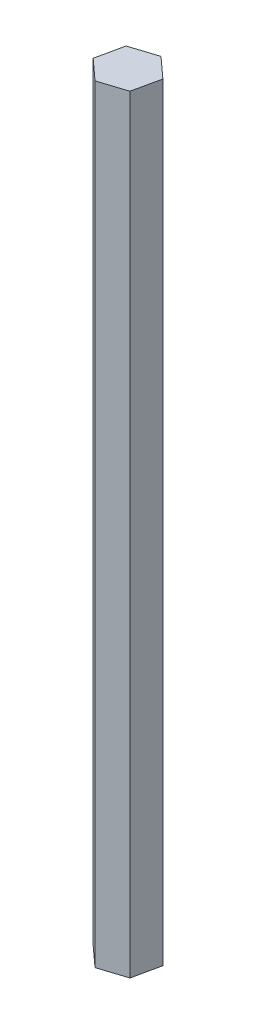
from build123d import *

# Parameters (mm, degrees)
BOSS_EXTRUDE1_DEPTH = 127
SKETCH3_W           = 20.194547067
SKETCH3_H           = 18.170773651
CUT_EXTRUDE1_DEPTH  = 38.1
BOSS_EXTRUDE2_DEPTH = 2.54
SKETCH5_W           = 34.517572909
SKETCH5_H           = 22.340458643
CUT_EXTRUDE2_DEPTH  = 50
BOSS_EXTRUDE3_DEPTH = 25
BOSS_EXTRUDE4_DEPTH = 13.5


with BuildPart() as part:
    # Sketch2 → Boss-Extrude1 (new body)
    with BuildSketch(Plane(origin=(0, 0, 0), x_dir=(1, 0, 0), z_dir=(0, 1, 0))):
        Polygon((2.137295047, -1.940438924), (2.749116926, 0.880732344), (0.611821879, 2.821171268), (-2.137295047, 1.940438924), (-2.749116926, -0.880732344), (-0.611821879, -2.821171268), align=None)
    extrude(amount=BOSS_EXTRUDE1_DEPTH)

    # Sketch3 → Cut-Extrude1 (cut)
    with BuildSketch(Plane.XZ):
        with Locations((-3.121926418, 0.771419978)):
            Rectangle(SKETCH3_W, SKETCH3_H)
    extrude(amount=-CUT_EXTRUDE1_DEPTH, mode=Mode.SUBTRACT)

    # Sketch4 → Boss-Extrude2 (add)
    with BuildSketch(Plane.XZ.offset(-38.1)):
        Polygon((0.611821879, -2.821171268), (2.749116926, -0.880732344), (2.137295047, 1.940438924), (-0.611821879, 2.821171268), (-2.749116926, 0.880732344), (-2.137295047, -1.940438924), align=None)
    extrude(amount=BOSS_EXTRUDE2_DEPTH)

    # Sketch5 → Cut-Extrude2 (cut)
    with BuildSketch(Plane.XZ.offset(-35.56)):
        with Locations((-1.3482575, -1.032578251)):
            Rectangle(SKETCH5_W, SKETCH5_H)
    extrude(amount=-CUT_EXTRUDE2_DEPTH, mode=Mode.SUBTRACT)

    # Sketch7 → Boss-Extrude3 (add)
    with BuildSketch(Plane.XZ.offset(-85.56)):
        Polygon((0.611821879, -2.821171268), (2.749116926, -0.880732344), (2.137295047, 1.940438924), (-0.611821879, 2.821171268), (-2.749116926, 0.880732344), (-2.137295047, -1.940438924), align=None)
    extrude(amount=BOSS_EXTRUDE3_DEPTH)

    # Sketch8 → Boss-Extrude4 (add)
    with BuildSketch(Plane.XZ.offset(-60.56)):
        Polygon((0.611821879, -2.821171268), (2.749116926, -0.880732344), (2.137295047, 1.940438924), (-0.611821879, 2.821171268), (-2.749116926, 0.880732344), (-2.137295047, -1.940438924), align=None)
    extrude(amount=BOSS_EXTRUDE4_DEPTH)


solid = part.part
